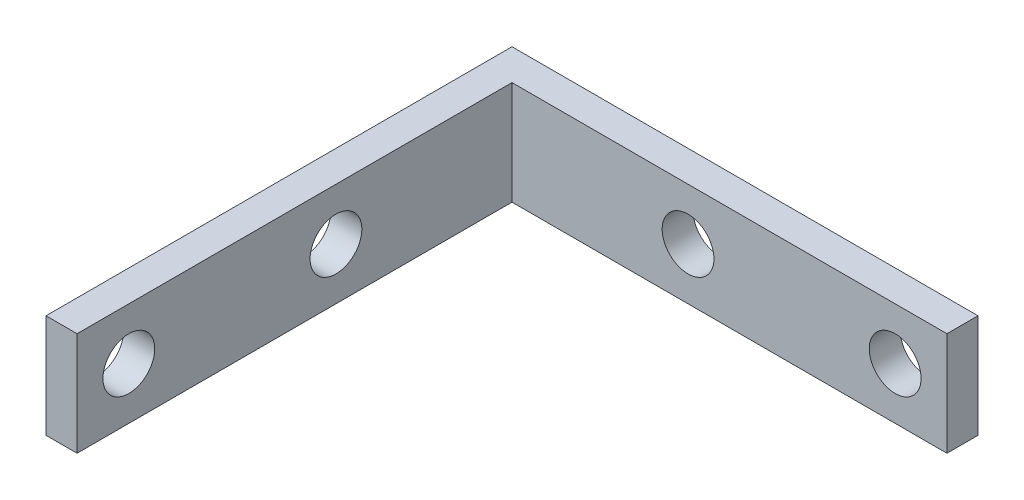
from build123d import *

# Parameters (mm, degrees)
SKETCH1_W           = 45
SKETCH1_H           = 10
SKETCH1_R           = 2.5
BOSS_EXTRUDE1_DEPTH = 3
SKETCH2_W           = 3
SKETCH2_H           = 10
BOSS_EXTRUDE2_DEPTH = 42
SKETCH3_R           = 2.5
CUT_EXTRUDE1_DEPTH  = 3


with BuildPart() as part:
    # Sketch1 → Boss-Extrude1 (new body)
    with BuildSketch(Plane.XY):
        with Locations((22.5, 5)):
            Rectangle(SKETCH1_W, SKETCH1_H)
        with Locations((20, 5)):
            Circle(SKETCH1_R, mode=Mode.SUBTRACT)
        with Locations((40, 5)):
            Circle(SKETCH1_R, mode=Mode.SUBTRACT)
    extrude(amount=BOSS_EXTRUDE1_DEPTH)

    # Sketch2 → Boss-Extrude2 (add)
    with BuildSketch(Plane.XY.offset(3)):
        with Locations((1.5, 5)):
            Rectangle(SKETCH2_W, SKETCH2_H)
    extrude(amount=BOSS_EXTRUDE2_DEPTH)

    # Sketch3 → Cut-Extrude1 (cut)
    with BuildSketch(Plane(origin=(3, 0, 0), x_dir=(0, 0, -1), z_dir=(1, 0, 0))):
        with Locations(Location((-20, 5, 0), (0, 0, 90))):
            Circle(SKETCH3_R)
        with Locations(Location((-40, 5, 0), (0, 0, 90))):
            Circle(SKETCH3_R)
    extrude(amount=-CUT_EXTRUDE1_DEPTH, mode=Mode.SUBTRACT)


solid = part.part
